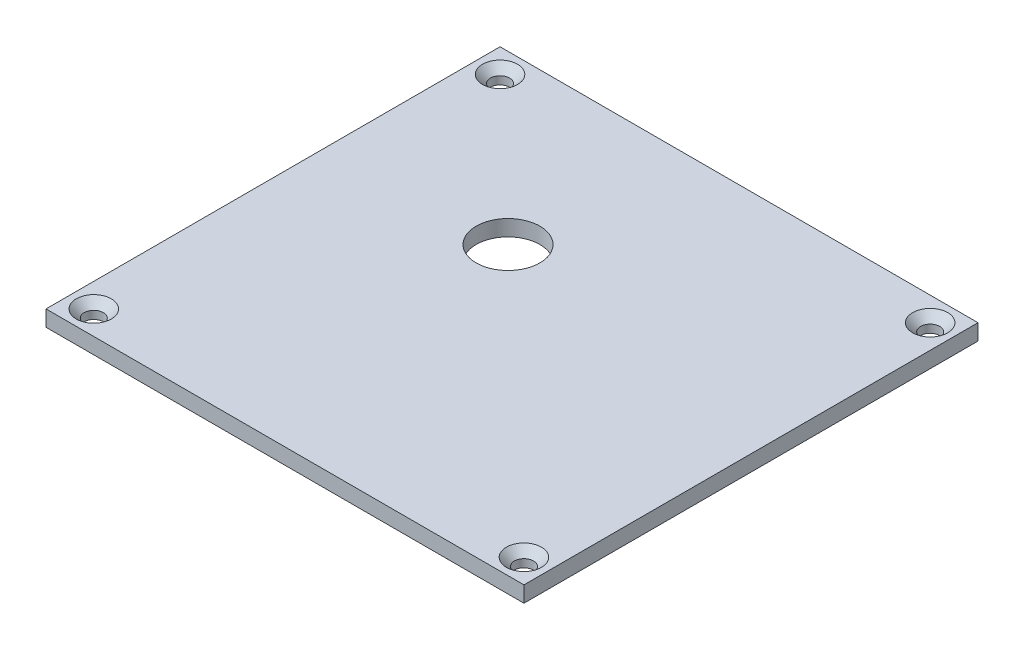
from build123d import *

# Parameters (mm, degrees)
SKETCH1_W                                    = 60
SKETCH1_H                                    = 57
BOSS_EXTRUDE1_DEPTH                          = 2
CSK_FOR_M2_COUNTERSUNK_FLAT_HEAD_SCR_2_COUNT = 2
CSK_FOR_M2_COUNTERSUNK_FLAT_HEAD_SCR_2_PITCH = 54
CSK_FOR_M2_COUNTERSUNK_FLAT_HEAD_SCR_3_COUNT = 2
CSK_FOR_M2_COUNTERSUNK_FLAT_HEAD_SCR_3_PITCH = 74.276510419
CSK_FOR_M2_COUNTERSUNK_FLAT_HEAD_SCR_4_COUNT = 2
CSK_FOR_M2_COUNTERSUNK_FLAT_HEAD_SCR_4_PITCH = 51
SKETCH4_R                                    = 4
CUT_EXTRUDE1_DEPTH                           = 2


with BuildPart() as part:
    # Sketch1 → Boss-Extrude1 (new body)
    with BuildSketch(Plane(origin=(0, 0, 0), x_dir=(1, 0, 0), z_dir=(0, 1, 0))):
        Rectangle(SKETCH1_W, SKETCH1_H)
    extrude(amount=BOSS_EXTRUDE1_DEPTH)

    # Sketch3 → CSK for M2 Countersunk Flat Head Screw1 (revolve, cut)
    with BuildSketch(Plane(origin=(-27, 2, -25.5), x_dir=(0, 0, 1), z_dir=(1, 0, 0))):
        Polygon((0, 0), (0, 2), (1.2, 2), (1.2, 1), (2.2, 0), align=None)
    csk_for_m2_countersunk_flat_head_screw1 = revolve(axis=Axis((-27, 8.35, -25.5), (0, -1, 0)), mode=Mode.SUBTRACT)

    # CSK for M2 Countersunk Flat Head Scr 2: CSK for M2 Countersunk Flat Head Screw1 ×2
    with Locations(*[(i * CSK_FOR_M2_COUNTERSUNK_FLAT_HEAD_SCR_2_PITCH, 0, 0) for i in range(1, CSK_FOR_M2_COUNTERSUNK_FLAT_HEAD_SCR_2_COUNT)]):
        add(csk_for_m2_countersunk_flat_head_screw1, mode=Mode.SUBTRACT)

    # CSK for M2 Countersunk Flat Head Scr 3: CSK for M2 Countersunk Flat Head Screw1 ×2
    with Locations(*[Vector(0.7270131525498175, 0, 0.6866235329637166) * (i * CSK_FOR_M2_COUNTERSUNK_FLAT_HEAD_SCR_3_PITCH) for i in range(1, CSK_FOR_M2_COUNTERSUNK_FLAT_HEAD_SCR_3_COUNT)]):
        add(csk_for_m2_countersunk_flat_head_screw1, mode=Mode.SUBTRACT)

    # CSK for M2 Countersunk Flat Head Scr 4: CSK for M2 Countersunk Flat Head Screw1 ×2
    with Locations(*[(0, 0, i * CSK_FOR_M2_COUNTERSUNK_FLAT_HEAD_SCR_4_PITCH) for i in range(1, CSK_FOR_M2_COUNTERSUNK_FLAT_HEAD_SCR_4_COUNT)]):
        add(csk_for_m2_countersunk_flat_head_screw1, mode=Mode.SUBTRACT)

    # Sketch4 → Cut-Extrude1 (cut)
    with BuildSketch(Plane(origin=(0, 2, 0), x_dir=(1, 0, 0), z_dir=(0, 1, 0))):
        with Locations(Location((-8, 7.5, 0), (0, 0, 270))):
            Circle(SKETCH4_R)
    extrude(amount=-CUT_EXTRUDE1_DEPTH, mode=Mode.SUBTRACT)


solid = part.part
